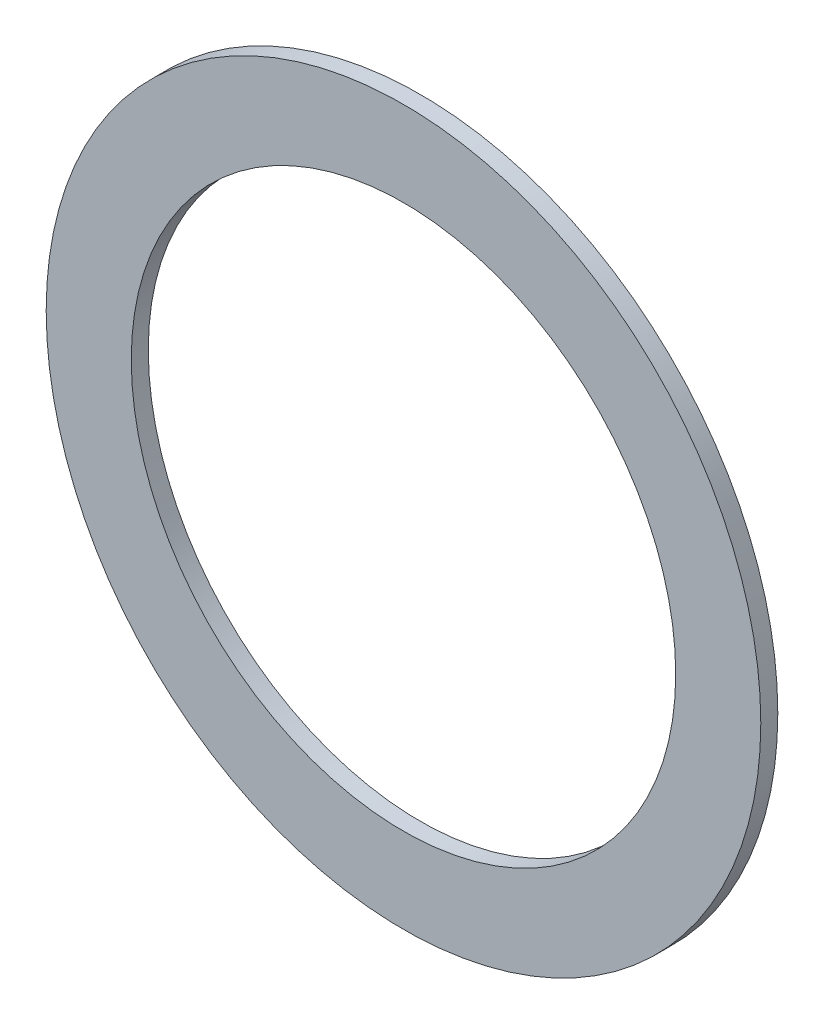
from build123d import *

# Parameters (mm, degrees)
ESQUISSE1_R        = 10.5
ESQUISSE1_R_2      = 8
BOSS_EXTRU_1_DEPTH = 0.5


with BuildPart() as part:
    # Esquisse1 → Boss.-Extru.1 (new body)
    with BuildSketch(Plane.XY):
        Circle(ESQUISSE1_R)
        Circle(ESQUISSE1_R_2, mode=Mode.SUBTRACT)
    extrude(amount=BOSS_EXTRU_1_DEPTH)


solid = part.part
